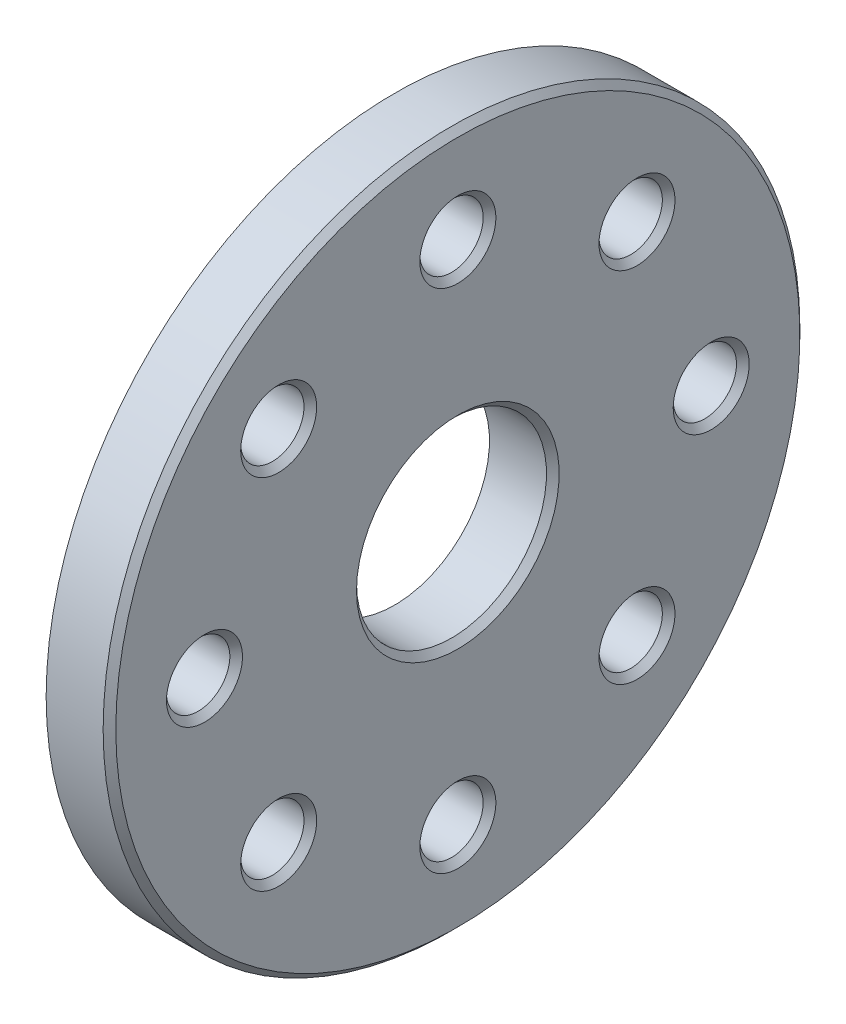
from build123d import *

# Parameters (mm, degrees)
SKETCH2_W          = 2
SKETCH2_H          = 8
SKETCH3_R          = 1
CUT_EXTRUDE1_DEPTH = 16.684387141
CIRPATTERN1_COUNT  = 8
CHAMFER1_SIZE      = 0.2


with BuildPart() as part:
    # Sketch2 → Revolve1 (revolve)
    with BuildSketch(Plane.XY, mode=Mode.PRIVATE) as revolve1_sk:
        with Locations((0, 7)):
            Rectangle(SKETCH2_W, SKETCH2_H)
    revolve(revolve1_sk.sketch.rotate(Axis((0, 0, 0), (1, 0, 0)), 90), axis=Axis((0, 0, 0), (1, 0, 0)))

    # Sketch3 → Cut-Extrude1 (cut, through all)
    with BuildSketch(Plane.ZY.offset(1)):
        with Locations((0, 8)):
            Circle(SKETCH3_R)
    cut_extrude1 = extrude(amount=-CUT_EXTRUDE1_DEPTH, mode=Mode.SUBTRACT)

    # CirPattern1: Cut-Extrude1 ×8 about axis
    cirpattern1_axis = Axis((0, 0, 0), (1, 0, 0))
    for i in range(1, CIRPATTERN1_COUNT):
        add(cut_extrude1.rotate(cirpattern1_axis, i * 360 / CIRPATTERN1_COUNT), mode=Mode.SUBTRACT)

    # Chamfer1
    chamfer1_edges = [part.edges().sort_by_distance(p)[0] for p in [
        (1, 8, -1),
        (1, 4.949747468, -6.363961031),
        (1, -1, -8),
        (1, -6.363961031, -4.949747468),
        (1, -8, 1),
        (1, -4.949747468, 6.363961031),
        (1, 1, 8),
        (1, 0, -3),
        (1, 0, -11),
        (1, 6.363961031, 4.949747468),
    ]]
    chamfer(chamfer1_edges, length=CHAMFER1_SIZE)


solid = part.part
